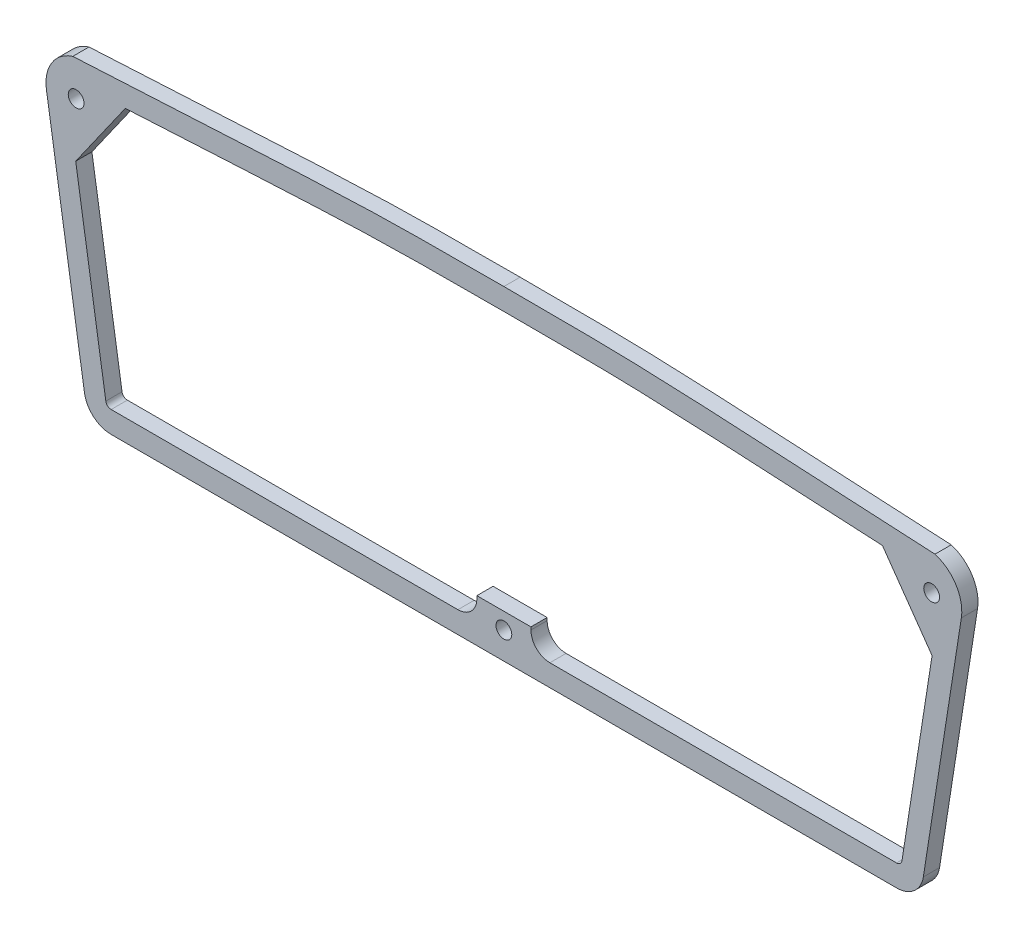
from build123d import *

# Parameters (mm, degrees)
SALIENTE_EXTRUIR3_DEPTH     = 3
CORTAR_EXTRUIR2_DEPTH       = 3
TALADRO_DE_MARGEN_PARA_32_D = 2.921
TALADRO_DE_MARGEN_PARA_33_D = 2.921


with BuildPart() as part:
    # Croquis1 → Saliente-Extruir3 (new body)
    with BuildSketch(Plane.XY):
        with BuildLine():
            Line((72.6209879, -42.713924632), (-72.6209879, -42.713924632))
            ThreePointArc((-72.6209879, -42.713924632), (-75.872299777, -41.512473181), (-77.561094305, -38.485513064))
            Line((-77.561094305, -38.485513064), (-84.58908741, 6.511317248))
            ThreePointArc((-84.58908741, 6.511317248), (-83.604933224, 11.307915351), (-79.718228228, 14.286075368))
            add(Edge.make_bspline(
                [(-79.718228228, 14.286075368), (-25, 17.286075368), (0, 17.286075368)],
                knots=[0, 0, 0, 1, 1, 1], degree=2, weights=[1, 3, 1]))
            add(Edge.make_bspline(
                [(79.718228228, 14.286075368), (25, 17.286075368), (0, 17.286075368)],
                knots=[0, 0, 0, 1, 1, 1], degree=2, weights=[1, 3, 1]))
            ThreePointArc((79.718228228, 14.286075368), (83.604933224, 11.307915351), (84.58908741, 6.511317248))
            Line((84.58908741, 6.511317248), (77.561094305, -38.485513064))
            ThreePointArc((77.561094305, -38.485513064), (75.872299777, -41.512473181), (72.6209879, -42.713924632))
        make_face()
    extrude(amount=SALIENTE_EXTRUIR3_DEPTH)

    # Croquis10 → Cortar-Extruir2 (cut)
    with BuildSketch(Plane(origin=(0, 0, 0), x_dir=(-1, 0, 0), z_dir=(0, 0, -1))):
        with BuildLine():
            Line((-79.176075372, -2.225018285), (-70, 10.811605693))
            add(Edge.make_bspline(
                [(0, 13.286075368), (-3.29107307, 13.286075368), (-6.58212396, 13.282488286), (-13.16407998, 13.251741396), (-16.454989725, 13.224703129), (-23.036374427, 13.10281332), (-26.325620803, 13.003093227), (-32.901882392, 12.743822329), (-36.189082451, 12.589204896), (-46.04985995, 12.103432552), (-52.622202183, 11.751277505), (-62.796370664, 11.203428332), (-66.398209188, 11.007964378), (-70, 10.811605693)],
                knots=[0, 0, 0, 0, 0.125, 0.125, 0.25, 0.25, 0.375, 0.375, 0.5, 0.5, 0.75, 0.75, 0.887012418, 0.887012418, 0.887012418, 0.887012418], degree=3))
            add(Edge.make_bspline(
                [(70, 10.811605693), (66.398209009, 11.007964388), (62.796370304, 11.203428352), (52.622201432, 11.751277545), (46.049858241, 12.103432641), (36.189081361, 12.589204947), (32.901882837, 12.743822313), (26.325619707, 13.003093268), (23.036367807, 13.1028135), (16.454979755, 13.224703256), (13.16407539, 13.251741426), (6.582121937, 13.282488287), (3.291072095, 13.286075368), (0, 13.286075368)],
                knots=[0.112987579, 0.112987579, 0.112987579, 0.112987579, 0.25, 0.25, 0.5, 0.5, 0.625, 0.625, 0.75, 0.75, 0.875, 0.875, 1, 1, 1, 1], degree=3))
            Line((70, 10.811605693), (79.176075372, -2.225018285))
            Line((79.176075372, -2.225018285), (73.609009181, -37.868242318))
            ThreePointArc((73.609009181, -37.868242318), (73.271250275, -38.473634342), (72.6209879, -38.713924632))
            Line((72.6209879, -38.713924632), (8.5, -38.713924632))
            ThreePointArc((8.5, -38.713924632), (6.025126266, -37.688798366), (5, -35.213924632))
            Line((5, -35.213924632), (5, -34.713924632))
            Line((5, -34.713924632), (-5, -34.713924632))
            Line((-5, -34.713924632), (-5, -35.213924632))
            ThreePointArc((-5, -35.213924632), (-6.025126266, -37.688798366), (-8.5, -38.713924632))
            Line((-8.5, -38.713924632), (-72.6209879, -38.713924632))
            ThreePointArc((-72.6209879, -38.713924632), (-73.271250275, -38.473634342), (-73.609009181, -37.868242318))
            Line((-73.609009181, -37.868242318), (-79.176075372, -2.225018285))
        make_face()
    extrude(amount=-CORTAR_EXTRUIR2_DEPTH, mode=Mode.SUBTRACT)

    # Taladro de margen para #32 (through all)
    with Locations(Plane(origin=(79.096485455, 7.800604527, 0), x_dir=(-1, 0, 0), z_dir=(0, 0, -1))):
        with Locations((0, 0), (158.19297091, 0)):
            Hole(TALADRO_DE_MARGEN_PARA_32_D / 2)

    # Taladro de margen para #33 (through all)
    with Locations(Plane(origin=(0, -37.713924632, 0), x_dir=(-1, 0, 0), z_dir=(0, 0, -1))):
        with Locations((0, 0)):
            Hole(TALADRO_DE_MARGEN_PARA_33_D / 2)


solid = part.part
